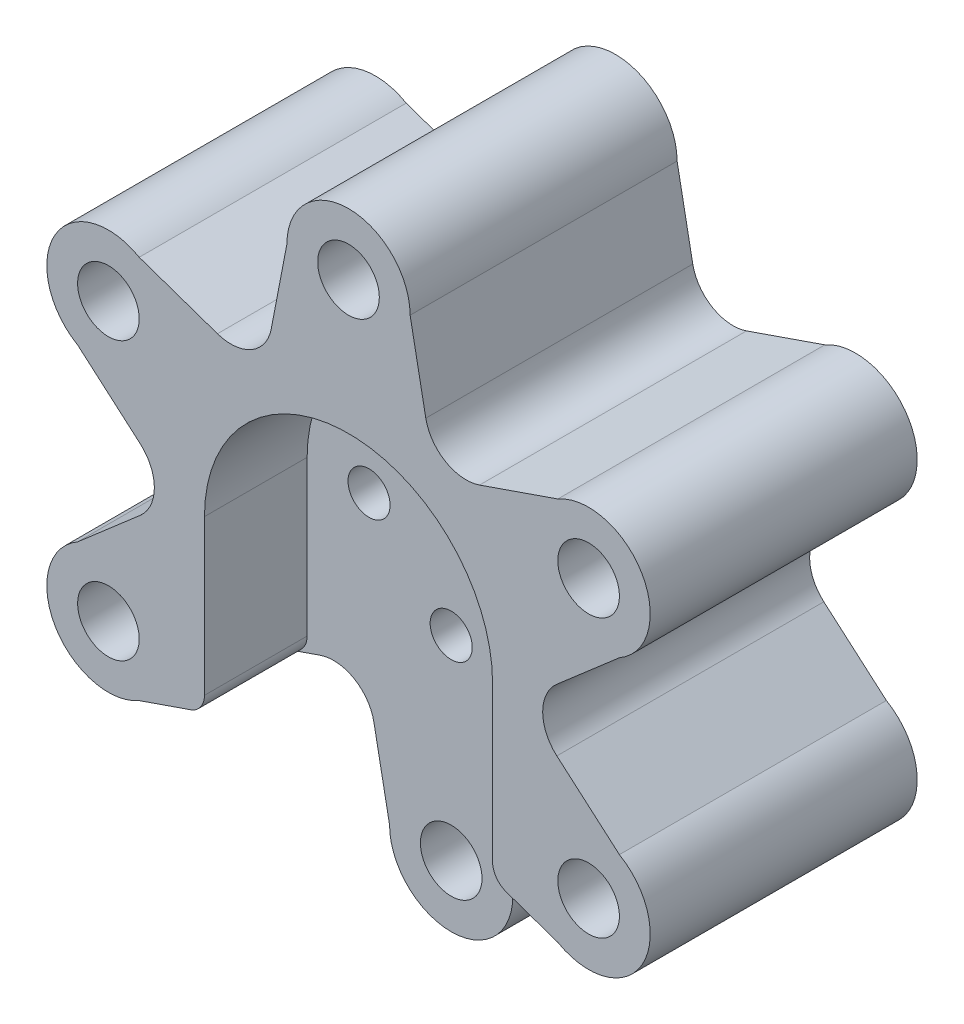
from build123d import *

# Parameters (mm, degrees)
SKETCH_2_R          = 18
SKETCH_2_R_2        = 1.4999999999999998
SKETCH_2_R_3        = 1.5000000000000022
SKETCH_2_R_4        = 1.5000000000000007
SKETCH_2_R_5        = 10.499999999999998
SKETCH_2_R_6        = 1.4999999999999987
EXTRUDE_1_DEPTH     = 8
EXTRUDE_START       = -4
SKETCH_6_R          = 10.499999999999998
EXTRUDE_2_DEPTH     = 4
SKETCH_7_R          = 2.9999999999999996
SKETCH_7_R_2        = 1.5000000000000004
SKETCH_7_R_3        = 1.5000000000000013
EXTRUDE_3_DEPTH     = 4
SKETCH_9_R          = 1.025
SKETCH_9_R_2        = 1.0250000000000001
CUT_EXTRUDE_2_DEPTH = 4
CUT_EXTRUDE_3_DEPTH = 13.000000000000002
CUT_EXTRUDE_4_DEPTH = 23
CUT_EXTRUDE_START   = -8
SKETCH_13_R         = 18
CUT_EXTRUDE_5_DEPTH = 8
FILLET_6_R          = 2
FILLET_7_R          = 2
SKETCH_22_R         = 26.500000000000004
CUT_EXTRUDE_7_DEPTH = 4
SKETCH_23_R         = 1.5000000000000024
SKETCH_23_R_2       = 1.4999999999999998
EXTRUDE_4_DEPTH     = 5
FILLET_8_R          = 1
EXTRUDE_START_2     = 4
SKETCH_24_R         = 1.0250000000000001
SKETCH_24_R_2       = 1.025
EXTRUDE_5_DEPTH     = 4


with BuildPart() as part:
    # 草图2 → 凸台-拉伸1 (new body)
    with BuildSketch(Plane.XY):
        Circle(SKETCH_2_R)
        with Locations((0, 13.5)):
            Circle(SKETCH_2_R_2, mode=Mode.SUBTRACT)
        with Locations((11.691342951089924, -6.749999999999998)):
            Circle(SKETCH_2_R_3, mode=Mode.SUBTRACT)
        with Locations((-11.691342951089919, -6.750000000000006)):
            Circle(SKETCH_2_R_4, mode=Mode.SUBTRACT)
        Circle(SKETCH_2_R_5, mode=Mode.SUBTRACT)
        with Locations((0, -13.5)):
            Circle(SKETCH_2_R_2, mode=Mode.SUBTRACT)
        with Locations((-11.691342951089924, 6.749999999999997)):
            Circle(SKETCH_2_R_6, mode=Mode.SUBTRACT)
        with Locations((11.691342951089919, 6.750000000000008)):
            Circle(SKETCH_2_R_4, mode=Mode.SUBTRACT)
    extrude(amount=EXTRUDE_1_DEPTH)

    # 草图6 → 凸台-拉伸2 (add)
    with BuildSketch(Plane.XY.offset(8).offset(EXTRUDE_START)):
        Circle(SKETCH_6_R)
    extrude(amount=EXTRUDE_2_DEPTH)

    # 草图9 → 切除-拉伸2 (cut)
    with BuildSketch(Plane.XY.offset(8)):
        with Locations((0, 4)):
            Circle(SKETCH_9_R)
        with Locations((-4, 2.4e-16)):
            Circle(SKETCH_9_R_2)
        with Locations((4.9e-16, -4)):
            Circle(SKETCH_9_R)
        with Locations((4, 2.4e-16)):
            Circle(SKETCH_9_R_2)
    extrude(amount=-CUT_EXTRUDE_2_DEPTH, mode=Mode.SUBTRACT)

    # 草图13 → 切除-拉伸5 (cut)
    with BuildSketch(Plane.XY.offset(8).offset(CUT_EXTRUDE_START)):
        Circle(SKETCH_13_R)
        with BuildLine():
            Line((-4.2, 7.274613391789286), (-3.0000000000000004, 13.5))
            ThreePointArc((-3.0000000000000004, 13.5), (1.8e-16, 16.5), (3.0000000000000004, 13.5))
            Line((3.0000000000000004, 13.5), (4.2, 7.274613391789286))
            Line((4.2, 7.274613391789286), (10.191342951089922, 9.348076211353316))
            ThreePointArc((10.19134295108992, 9.34807621135332), (13.19134295108992, 9.34807621135332), (14.691342951089922, 6.750000000000004))
            ThreePointArc((14.691342951089922, 6.7500000000000036), (14.289419162443235, 5.250000000000002), (13.191342951089917, 4.151923788646687))
            Line((13.19134295108992, 4.151923788646681), (8.4, 8.9e-16))
            Line((8.4, 8.9e-16), (13.19134295108992, -4.151923788646685))
            ThreePointArc((13.191342951089924, -4.151923788646679), (14.289419162443242, -5.249999999999996), (14.691342951089926, -6.749999999999997))
            ThreePointArc((14.691342951089926, -6.749999999999998), (13.191342951089924, -9.348076211353316), (10.191342951089919, -9.348076211353312))
            Line((10.191342951089919, -9.348076211353318), (4.200000000000001, -7.274613391789285))
            Line((4.200000000000001, -7.274613391789285), (2.999999999999996, -13.5))
            ThreePointArc((3.000000000000002, -13.5), (1.18e-15, -16.5), (-2.9999999999999987, -13.5))
            Line((-3.000000000000005, -13.499999999999996), (-4.199999999999998, -7.274613391789289))
            Line((-4.199999999999998, -7.274613391789289), (-10.191342951089924, -9.34807621135331))
            ThreePointArc((-10.191342951089917, -9.348076211353325), (-14.289419162443238, -8.250000000000007), (-13.191342951089919, -4.1519237886466875))
            Line((-13.191342951089924, -4.151923788646676), (-8.4, -6.22e-15))
            Line((-8.4, -6.22e-15), (-13.191342951089919, 4.151923788646697))
            ThreePointArc((-13.191342951089933, 4.151923788646676), (-14.289419162443243, 8.249999999999995), (-10.191342951089926, 9.348076211353307))
            Line((-10.191342951089913, 9.348076211353327), (-4.2, 7.274613391789286))
        make_face(mode=Mode.SUBTRACT)
    extrude(amount=CUT_EXTRUDE_5_DEPTH, mode=Mode.SUBTRACT)

    # 圆角6
    fillet_6_edges = [part.edges().sort_by_distance(p)[0] for p in [
        (-3.7087365602143945, 9.823200757743328, 2),
        (-4.2, 7.274613391789286, 6),
        (-10.361509682787466, -1.6997403017818833, 2),
        (-3.708736560214394, -9.823200757743328, 2),
        (6.652773122573071, -8.123460455961444, 2),
        (10.361509682787464, 1.6997403017818842, 2),
        (3.7087365602143936, 9.823200757743328, 2),
        (-6.652773122573068, 8.123460455961448, 2),
        (-10.361509682787464, 1.6997403017818868, 2),
        (-8.4, -6.22e-15, 6),
        (-6.652773122573072, -8.123460455961444, 2),
        (-4.199999999999998, -7.274613391789289, 6),
        (3.7087365602143914, -9.823200757743328, 2),
        (4.200000000000001, -7.274613391789285, 6),
        (10.361509682787466, -1.6997403017818833, 2),
        (8.4, 8.9e-16, 6),
        (6.652773122573071, 8.123460455961444, 2),
        (4.2, 7.274613391789286, 6),
    ]]
    fillet(fillet_6_edges, radius=FILLET_6_R)

    # 草图23 → 凸台-拉伸4 (add)
    with BuildSketch(Plane.XY.offset(8)):
        with BuildLine():
            Line((7.015, 0), (7.015, -8.248818655070188))
            Line((7.015, -8.248818655070188), (10.191342951089933, -9.348076211353321))
            ThreePointArc((10.191342951089933, -9.348076211353321), (14.289419162443245, -8.249999999999993), (13.19134295108992, -4.151923788646683))
            Line((13.19134295108992, -4.151923788646683), (10.144242051851217, -1.5114676912433453))
            ThreePointArc((10.144242051851217, -1.5114676912433453), (9.45399982271097, 1.11e-15), (10.144242051851217, 1.5114676912433471))
            Line((10.144242051851217, 1.5114676912433471), (13.19134295108992, 4.151923788646685))
            ThreePointArc((13.19134295108992, 4.151923788646685), (14.289419162443243, 8.249999999999995), (10.191342951089933, 9.348076211353321))
            Line((10.191342951089933, 9.348076211353321), (7.015, 8.248818655070192))
            Line((7.015, 8.248818655070192), (6.381090443541757, 8.029437473419858))
            ThreePointArc((6.381090443541757, 8.029437473419858), (4.726999911355481, 8.187404013841277), (3.7631516083094527, 9.540905164663204))
            Line((3.7631516083094527, 9.540905164663204), (2.9999999999999996, 13.5))
            ThreePointArc((2.9999999999999996, 13.5), (1.8e-16, 16.5), (-2.9999999999999996, 13.5))
            Line((-2.9999999999999996, 13.5), (-3.7631516083094527, 9.540905164663204))
            ThreePointArc((-3.7631516083094527, 9.540905164663204), (-4.726999911355481, 8.187404013841277), (-6.381090443541757, 8.029437473419858))
            Line((-6.381090443541757, 8.029437473419858), (-7.015, 8.248818655070192))
            Line((-7.015, 8.248818655070192), (-10.191342951089933, 9.348076211353321))
            ThreePointArc((-10.191342951089933, 9.348076211353321), (-14.289419162443243, 8.249999999999995), (-13.19134295108992, 4.151923788646685))
            Line((-13.19134295108992, 4.151923788646685), (-10.144242051851217, 1.5114676912433471))
            ThreePointArc((-10.144242051851217, 1.5114676912433471), (-9.45399982271097, 8.7e-16), (-10.144242051851217, -1.5114676912433453))
            Line((-10.144242051851217, -1.5114676912433453), (-13.19134295108992, -4.151923788646683))
            ThreePointArc((-13.19134295108992, -4.151923788646683), (-14.289419162443245, -8.249999999999993), (-10.191342951089933, -9.348076211353321))
            Line((-10.191342951089933, -9.348076211353321), (-7.015, -8.248818655070188))
            Line((-7.015, -8.248818655070188), (-7.015, 0))
            ThreePointArc((-7.015, 0), (4.3e-16, 7.015), (7.015, 0))
        make_face()
        with Locations((11.691342951089924, -6.749999999999998)):
            Circle(SKETCH_23_R, mode=Mode.SUBTRACT)
        with Locations(Location((11.691342951089924, 6.75, 0), (0, 0, 180))):
            Circle(SKETCH_23_R, mode=Mode.SUBTRACT)
        with Locations((0, 13.5)):
            Circle(SKETCH_23_R_2, mode=Mode.SUBTRACT)
        with Locations(Location((-11.691342951089924, -6.749999999999998, 0), (0, 0, 180))):
            Circle(SKETCH_23_R, mode=Mode.SUBTRACT)
        with Locations((-11.691342951089924, 6.75)):
            Circle(SKETCH_23_R, mode=Mode.SUBTRACT)
    extrude(amount=EXTRUDE_4_DEPTH)

    # 圆角8
    fillet_8_edges = [part.edges().sort_by_distance(p)[0] for p in [
        (7.015, -8.248818655070188, 10.5),
        (-7.015, -8.248818655070188, 10.5),
    ]]
    fillet(fillet_8_edges, radius=FILLET_8_R)

    # 草图24 → 凸台-拉伸5 (add)
    with BuildSketch(Plane(origin=(0, 0, 4), x_dir=(-1, 0, 0), z_dir=(0, 0, -1)).offset(EXTRUDE_START_2)):
        with BuildLine():
            Line((-3.7631516083094545, 9.540905164663204), (-3.130304023425084, 12.824005897977921))
            ThreePointArc((-3.130304023425084, 12.824005897977921), (-2.647549400093676, 11.101446750226756), (-0.9798228051184064, 10.454183242634018))
            ThreePointArc((-0.9798228051184064, 10.454183242634018), (6.4e-16, 10.499999999999998), (0.9798228051184061, 10.454183242634016))
            ThreePointArc((0.9798228051184061, 10.454183242634016), (2.647549400093674, 11.101446750226758), (3.130304023425079, 12.824005897977921))
            Line((3.130304023425079, 12.824005897977921), (3.763151608309469, 9.540905164663112))
            ThreePointArc((3.763151608309469, 9.540905164663112), (4.726999911355525, 8.187404013841222), (6.38109044354178, 8.029437473419842))
            Line((6.38109044354178, 8.029437473419842), (9.540762874217831, 9.122925754843699))
            ThreePointArc((9.540762874217831, 9.122925754843699), (8.290360204409751, 7.8435684133687325), (8.56367686137945, 6.075643061756859))
            ThreePointArc((8.56367686137945, 6.075643061756859), (9.093266739736617, 5.249999999999978), (9.54349966649785, 4.378540180877117))
            ThreePointArc((9.54349966649785, 4.378540180877117), (10.937909604503425, 3.2578783368579787), (12.671066897642891, 3.701080143134205))
            Line((12.671066897642891, 3.701080143134205), (10.14424205185114, 1.5114676912432894))
            ThreePointArc((10.14424205185114, 1.5114676912432894), (9.45399982271092, -7.925e-14), (10.144242051851208, -1.5114676912433949))
            Line((10.144242051851208, -1.5114676912433949), (12.671066897642879, -3.7010801431342593))
            ThreePointArc((12.671066897642879, -3.7010801431342593), (10.937909604503396, -3.257878336858057), (9.543499666497823, -4.378540180877186))
            ThreePointArc((9.543499666497823, -4.378540180877186), (9.093266739736583, -5.250000000000044), (8.563676861379406, -6.075643061756919))
            ThreePointArc((8.563676861379406, -6.075643061756919), (8.290360204409705, -7.843568413368805), (9.540762874217815, -9.122925754843717))
            Line((9.540762874217815, -9.122925754843717), (6.381090443541676, -8.029437473419822))
            ThreePointArc((6.381090443541676, -8.029437473419822), (4.726999911355367, -8.187404013841265), (3.763151608309388, -9.540905164663233))
            Line((3.763151608309388, -9.540905164663233), (3.1303040234249946, -12.824005897977946))
            ThreePointArc((3.1303040234249946, -12.824005897977946), (2.647549400093598, -11.101446750226778), (0.9798228051183333, -10.454183242634029))
            ThreePointArc((0.9798228051183333, -10.454183242634029), (-7.396e-14, -10.500000000000002), (-0.9798228051184793, -10.454183242634013))
            ThreePointArc((-0.9798228051184793, -10.454183242634013), (-2.647549400093763, -11.101446750226756), (-3.130304023425077, -12.824005897977921))
            Line((-3.130304023425077, -12.824005897977921), (-3.763151608309468, -9.540905164663112))
            ThreePointArc((-3.763151608309468, -9.540905164663112), (-4.726999911355536, -8.187404013841146), (-6.381090443541838, -8.029437473419797))
            Line((-6.381090443541838, -8.029437473419797), (-9.540762874217897, -9.122925754843633))
            ThreePointArc((-9.540762874217897, -9.122925754843633), (-8.29036020440981, -7.843568413368676), (-8.563676861379493, -6.075643061756799))
            ThreePointArc((-8.563676861379493, -6.075643061756799), (-9.093266739736658, -5.249999999999916), (-9.543499666497883, -4.378540180877051))
            ThreePointArc((-9.543499666497883, -4.378540180877051), (-10.937909604503469, -3.2578783368579), (-12.67106689764289, -3.70108014313421))
            Line((-12.67106689764289, -3.70108014313421), (-10.14424205185114, -1.5114676912432934))
            ThreePointArc((-10.14424205185114, -1.5114676912432934), (-9.453999822710855, 1.3597e-13), (-10.14424205185128, 1.5114676912434042))
            Line((-10.14424205185128, 1.5114676912434042), (-12.671066897642895, 3.7010801431342033))
            ThreePointArc((-12.671066897642895, 3.7010801431342033), (-10.937909604503313, 3.2578783368580044), (-9.54349966649779, 4.378540180877251))
            ThreePointArc((-9.54349966649779, 4.378540180877251), (-9.093266739736544, 5.250000000000108), (-8.563676861379363, 6.075643061756977))
            ThreePointArc((-8.563676861379363, 6.075643061756977), (-8.290360204409655, 7.84356841336888), (-9.540762874217819, 9.12292575484371))
            Line((-9.540762874217819, 9.12292575484371), (-6.381090443541672, 8.029437473419822))
            ThreePointArc((-6.381090443541672, 8.029437473419822), (-4.72699991135544, 8.187404013841295), (-3.7631516083094545, 9.540905164663204))
        make_face()
        with Locations(Location((-4, 2.4e-16, 0), (0, 0, 180))):
            Circle(SKETCH_24_R, mode=Mode.SUBTRACT)
        with Locations(Location((0, 4, 0), (0, 0, 180))):
            Circle(SKETCH_24_R_2, mode=Mode.SUBTRACT)
        with Locations(Location((4, 2.4e-16, 0), (0, 0, 180))):
            Circle(SKETCH_24_R, mode=Mode.SUBTRACT)
        with Locations(Location((-4.9e-16, -4, 0), (0, 0, 180))):
            Circle(SKETCH_24_R_2, mode=Mode.SUBTRACT)
    extrude(amount=-EXTRUDE_5_DEPTH)


with BuildPart() as body_2:
    # 草图7 → 凸台-拉伸3 (new body)
    with BuildSketch(Plane.XY.offset(8)):
        with BuildLine():
            Line((-7.5, 0), (-7.5, 20))
            ThreePointArc((-7.5, 20), (4.6e-16, 27.5), (7.5, 20))
            Line((7.5, 20), (7.5, 0))
            ThreePointArc((7.5, 0), (-1.38e-15, -7.5), (-7.5, 0))
        make_face()
        with Locations((0, 20)):
            Circle(SKETCH_7_R, mode=Mode.SUBTRACT)
        with Locations((0, 4)):
            Circle(SKETCH_7_R_2, mode=Mode.SUBTRACT)
        with Locations((4, 2.4e-16)):
            Circle(SKETCH_7_R_3, mode=Mode.SUBTRACT)
        with Locations((4.9e-16, -4)):
            Circle(SKETCH_7_R_2, mode=Mode.SUBTRACT)
        with Locations((-4, 2.4e-16)):
            Circle(SKETCH_7_R_3, mode=Mode.SUBTRACT)
    extrude(amount=EXTRUDE_3_DEPTH)

    # 草图11 → 切除-拉伸3 (cut)
    with BuildSketch(Plane.XY.offset(12)):
        with BuildLine():
            Line((-7.5, 18.26794919243113), (-6.5, 20))
            ThreePointArc((-6.500000000000001, 20), (4e-16, 26.5), (6.500000000000001, 20))
            Line((6.500000000000002, 20), (7.5000000000000036, 18.267949192431132))
            Line((7.5, 18.267949192431132), (7.5, 20))
            ThreePointArc((7.5, 20), (2.12e-15, 27.5), (-7.5, 20.000000000000004))
            Line((-7.5, 20), (-7.5, 18.26794919243113))
        make_face()
    extrude(amount=-CUT_EXTRUDE_3_DEPTH, mode=Mode.SUBTRACT)

    # 草图12 → 切除-拉伸4 (cut)
    with BuildSketch(Plane.XY.offset(12)):
        with BuildLine():
            Line((2.800000000000002, 12), (2.800000000000002, 10))
            ThreePointArc((2.800000000000002, 10), (1.93e-15, 7.199999999999999), (-2.7999999999999976, 10))
            Line((-2.7999999999999976, 10), (-2.7999999999999976, 12))
            ThreePointArc((-2.7999999999999976, 12), (2.38e-15, 14.8), (2.800000000000002, 12))
        make_face()
    extrude(amount=-CUT_EXTRUDE_4_DEPTH, mode=Mode.SUBTRACT)

    # 草图20 → M4 六角凹锥坑螺钉的锥形沉头孔2 (revolve, cut)
    with BuildSketch(Plane(origin=(0, 20, 8), x_dir=(0, 1, 0), z_dir=(1, 0, 0))):
        Polygon((0, 0), (-2.78e-15, 11.35193639281201), (2.2499999999999982, 10), (2.249999999999999, 2.2300000000000004), (4.480000000000001, -1.73e-15), align=None)
    revolve(axis=Axis((0, 20, 1.6500000000000092), (0, 0, 1)), mode=Mode.SUBTRACT)

    # 圆角7
    fillet_7_edges = [body_2.edges().sort_by_distance(p)[0] for p in [
        (-7.5, 18.26794919243113, 10),
        (6.500000000000002, 20, 10),
        (7.500000000000002, 18.267949192431132, 10),
        (-6.5, 20, 10),
    ]]
    fillet(fillet_7_edges, radius=FILLET_7_R)

    # 草图22 → 切除-拉伸7 (cut)
    with BuildSketch(Plane.XY.offset(12)):
        Circle(SKETCH_22_R)
    extrude(amount=-CUT_EXTRUDE_7_DEPTH, mode=Mode.SUBTRACT)


solid = part.part
